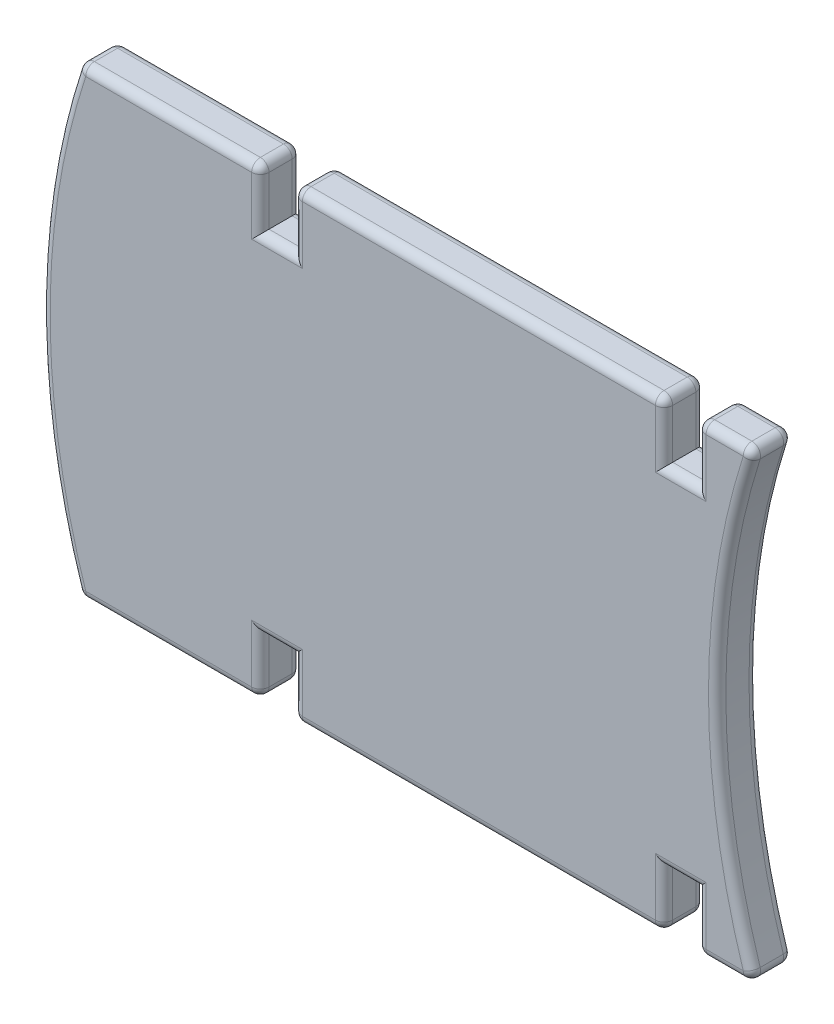
from build123d import *

# Parameters (mm, degrees)
BOSS_EXTRU_1_DEPTH = 2.8
CONG_1_R           = 0.6


with BuildPart() as part:
    # Esquisse1 → Boss.-Extru.1 (new body)
    with BuildSketch(Plane.XY):
        with BuildLine():
            Line((-47.370877129, 16), (-34.870877129, 16))
            Line((-34.870877129, 16), (-34.870877129, 12))
            Line((-34.870877129, 12), (-32.570877129, 12))
            Line((-32.570877129, 12), (-32.570877129, 16))
            Line((-32.570877129, 16), (-6.970877129, 16))
            Line((-6.970877129, 16), (-6.970877129, 12))
            Line((-6.970877129, 12), (-4.670877129, 12))
            Line((-4.670877129, 12), (-4.670877129, 16))
            Line((-4.670877129, 16), (-0.670877129, 16))
            ThreePointArc((-0.670877129, 16), (-3.3, 0), (-0.670877129, -16))
            Line((-0.670877129, -16), (-4.670877129, -16))
            Line((-4.670877129, -16), (-4.670877129, -12))
            Line((-4.670877129, -12), (-6.970877129, -12))
            Line((-6.970877129, -12), (-6.970877129, -16))
            Line((-6.970877129, -16), (-32.570877129, -16))
            Line((-32.570877129, -16), (-32.570877129, -12))
            Line((-32.570877129, -12), (-34.870877129, -12))
            Line((-34.870877129, -12), (-34.870877129, -16))
            Line((-34.870877129, -16), (-47.370877129, -16))
            ThreePointArc((-47.370877129, -16), (-50, 0), (-47.370877129, 16))
        make_face()
    extrude(amount=BOSS_EXTRU_1_DEPTH)

    # Congé1
    cong_1_edges = [part.edges().sort_by_distance(p)[0] for p in [
        (-34.870877129, -14, 2.8),
        (-33.720877129, -12, 2.8),
        (-32.570877129, -14, 2.8),
        (-41.120877129, 16, 0),
        (-34.870877129, 14, 0),
        (-33.720877129, 12, 0),
        (-32.570877129, 14, 0),
        (-19.770877129, 16, 0),
        (-19.770877129, -16, 2.8),
        (-6.970877129, 14, 0),
        (-5.820877129, 12, 0),
        (-4.670877129, 14, 0),
        (-2.670877129, 16, 0),
        (-3.3, 0, 0),
        (-2.670877129, -16, 0),
        (-4.670877129, -14, 0),
        (-6.970877129, -14, 2.8),
        (-5.820877129, -12, 0),
        (-6.970877129, -14, 0),
        (-19.770877129, -16, 0),
        (-32.570877129, -14, 0),
        (-33.720877129, -12, 0),
        (-34.870877129, -14, 0),
        (-41.120877129, -16, 0),
        (-50, 0, 0),
        (-5.820877129, -12, 2.8),
        (-4.670877129, -14, 2.8),
        (-2.670877129, -16, 2.8),
        (-47.370877129, 16, 1.4),
        (-34.870877129, 16, 1.4),
        (-32.570877129, 16, 1.4),
        (-6.970877129, 16, 1.4),
        (-4.670877129, 16, 1.4),
        (-0.670877129, 16, 1.4),
        (-0.670877129, -16, 1.4),
        (-4.670877129, -16, 1.4),
        (-6.970877129, -16, 1.4),
        (-32.570877129, -16, 1.4),
        (-34.870877129, -16, 1.4),
        (-47.370877129, -16, 1.4),
        (-3.3, 0, 2.8),
        (-2.670877129, 16, 2.8),
        (-50, 0, 2.8),
        (-4.670877129, 14, 2.8),
        (-5.820877129, 12, 2.8),
        (-6.970877129, 14, 2.8),
        (-19.770877129, 16, 2.8),
        (-32.570877129, 14, 2.8),
        (-33.720877129, 12, 2.8),
        (-34.870877129, 14, 2.8),
        (-41.120877129, 16, 2.8),
        (-41.120877129, -16, 2.8),
    ]]
    fillet(cong_1_edges, radius=CONG_1_R)


solid = part.part
